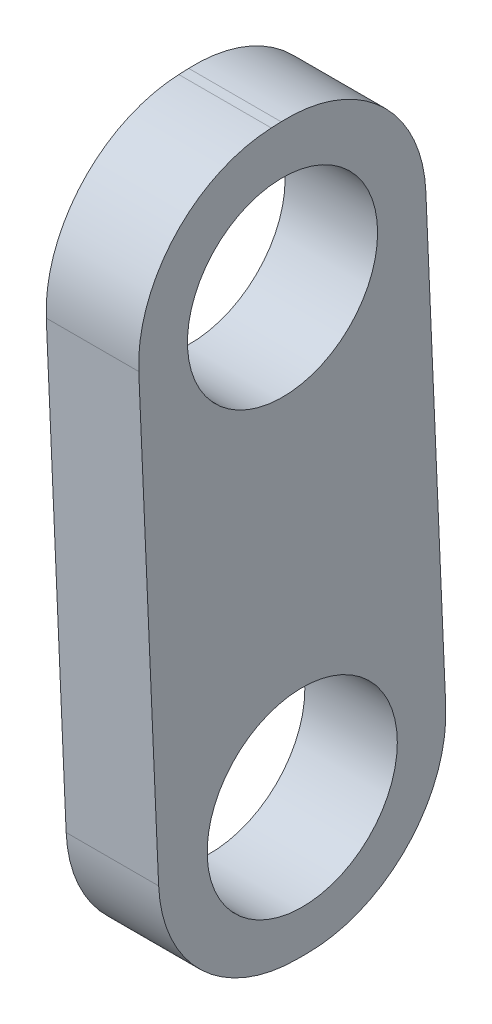
from build123d import *

# Parameters (mm, degrees)
SKETCH1_R           = 3.2639
BOSS_EXTRUDE1_DEPTH = 3.175
FILLET2_R           = 4.7625
SKETCH3_R           = 3.2639
CUT_EXTRUDE1_DEPTH  = 3.175


with BuildPart() as part:
    # Sketch1 → Boss-Extrude1 (new body)
    with BuildSketch(Plane(origin=(0, 0, 0), x_dir=(0, 0, -1), z_dir=(1, 0, 0))):
        Polygon((182.388740953, 7.963264406), (181.834774733, 20.65117682), (171.980710149, 20.220939069), (173.069858002, -4.724648008), (182.942707172, -4.724648008), align=None)
        with Locations((177.123417321, 15.496291061)):
            Circle(SKETCH1_R, mode=Mode.SUBTRACT)
        with Locations((177.8, 0)):
            Circle(SKETCH1_R, mode=Mode.SUBTRACT)
    extrude(amount=BOSS_EXTRUDE1_DEPTH)

    # Fillet2
    fillet2_edges = [part.edges().sort_by_distance(p)[0] for p in [
        (1.5875, -4.724648008, -182.942707172),
        (1.5875, -4.724648008, -173.069858002),
        (1.5875, 20.220939069, -171.980710149),
        (1.5875, 20.65117682, -181.834774733),
    ]]
    fillet(fillet2_edges, radius=FILLET2_R)

    # Sketch3 → Cut-Extrude1 (cut)
    with BuildSketch(Plane(origin=(0, 7.963264406, -182.388740953), x_dir=(-1, 0, 0), z_dir=(0, 0.04361938736533578, -0.9990482215818579))):
        with Locations((0.79375, 0.106236202)):
            Circle(SKETCH3_R)
    extrude(amount=-CUT_EXTRUDE1_DEPTH, mode=Mode.SUBTRACT)


solid = part.part
